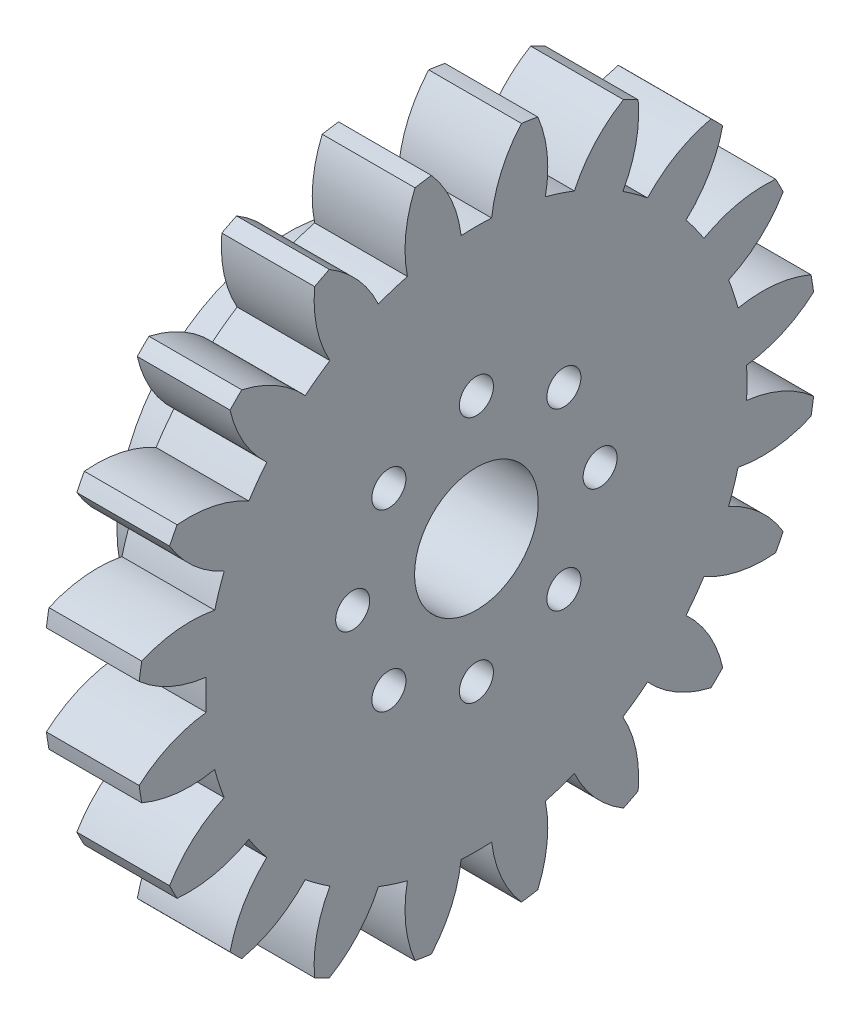
from build123d import *

# Parameters (mm, degrees)
BASPROSKE_W          = 6
BASPROSKE_H          = 22
TOOTHCUT_DEPTH       = 32.685959036
TEETHCUTS_COUNT      = 20
TEETHCUTS_ANGLE      = 342
HUBNEAONESKE_R       = 11
HUBNEARONE_DEPTH     = 6.2500508
BORSKE_R             = 4
BORE_DEPTH           = 12.2500508
M2_CLEARANCE_HOLE1_D = 2.2


with BuildPart() as part:
    # BasProSke → Base-Revolve (revolve)
    with BuildSketch(Plane(origin=(0, 0, 0), x_dir=(1, 0, 0), z_dir=(0, 1, 0)), mode=Mode.PRIVATE) as base_revolve_sk:
        with Locations((3, 11)):
            Rectangle(BASPROSKE_W, BASPROSKE_H)
    revolve(base_revolve_sk.sketch.rotate(Axis((-10, 0, 0), (1, 0, 0)), 180), axis=Axis((-10, 0, 0), (1, 0, 0)))

    # TooCutSke → ToothCut (cut, through all)
    with BuildSketch(Plane(origin=(0, 0, 0), x_dir=(0, 0, -1), z_dir=(1, 0, 0))):
        with BuildLine():
            ThreePointArc((0.986171591, 17.471189616), (0, 17.499), (-0.986171591, 17.471189616))
            ThreePointArc((-0.986171591, 17.471189616), (-1.626916196, 19.798789858), (-2.932850173, 21.829260982))
            ThreePointArc((-2.932850173, 21.829260982), (0, 22.0254), (2.932850173, 21.829260982))
            ThreePointArc((2.932850173, 21.829260982), (1.626916196, 19.798789858), (0.986171591, 17.471189616))
        make_face()
    toothcut = extrude(amount=TOOTHCUT_DEPTH, mode=Mode.SUBTRACT)

    # TeethCuts: ToothCut ×20 about axis
    teethcuts_axis = Axis((-10, 0, 0), (1, 0, 0))
    for i in range(1, TEETHCUTS_COUNT):
        add(toothcut.rotate(teethcuts_axis, i * TEETHCUTS_ANGLE / (TEETHCUTS_COUNT - 1)), mode=Mode.SUBTRACT)

    # HubNeaOneSke → HubNearOne (add)
    with BuildSketch(Plane.ZY):
        with Locations(Location((0, 0, 0), (0, 0, 180))):
            Circle(HUBNEAONESKE_R)
    extrude(amount=HUBNEARONE_DEPTH)

    # BorSke → Bore (cut, symmetric)
    with BuildSketch(Plane(origin=(0, 0, 0), x_dir=(0, 0, -1), z_dir=(1, 0, 0))):
        with Locations(Location((0, 0, 0), (0, 0, 180))):
            Circle(BORSKE_R)
    extrude(amount=BORE_DEPTH, both=True, mode=Mode.SUBTRACT)

    # M2 Clearance Hole1 (through all)
    with Locations(Plane(origin=(6, 0, 0), x_dir=(0, 0, -1), z_dir=(1, 0, 0))):
        with Locations((0, 8), (5.656854249, 5.656854249), (8, 0), (5.656854249, -5.656854249), (0, -8), (-5.656854249, -5.656854249), (-8, 0), (-5.656854249, 5.656854249)):
            Hole(M2_CLEARANCE_HOLE1_D / 2)


solid = part.part
